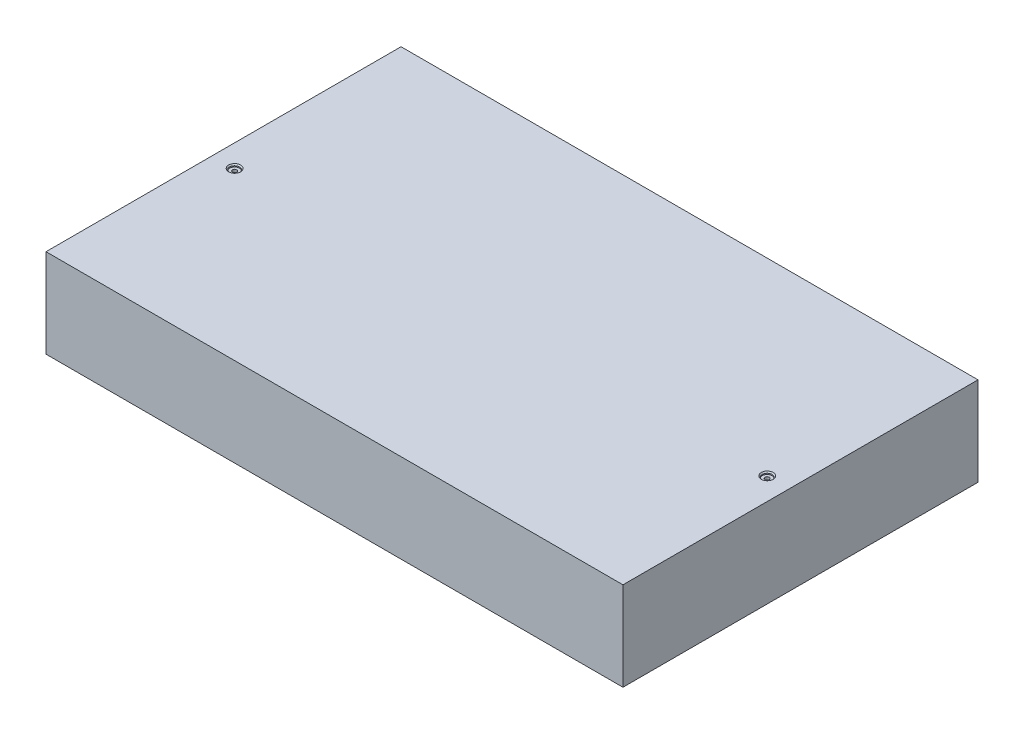
from build123d import *

# Parameters (mm, degrees)
SKETCH1_W                                   = 330.2
SKETCH1_H                                   = 203.2
BOSS_EXTRUDE1_DEPTH                         = 50.8
CUT_EXTRUDE1_DEPTH                          = 12.7
CBORE_FOR_2_BINDING_HEAD_MACHINE_SC_2_COUNT = 2
CBORE_FOR_2_BINDING_HEAD_MACHINE_SC_2_PITCH = 304.799059425


with BuildPart() as part:
    # Sketch1 → Boss-Extrude1 (new body)
    with BuildSketch(Plane(origin=(0, 0, 0), x_dir=(1, 0, 0), z_dir=(0, 1, 0))):
        with Locations((165.1, 101.6)):
            Rectangle(SKETCH1_W, SKETCH1_H)
    extrude(amount=BOSS_EXTRUDE1_DEPTH)

    # Sketch3 → Cut-Extrude1 (cut)
    with BuildSketch(Plane.XZ):
        Polygon((279.4, -181.265982614), (279.4, -104.941398829), (279.4, -104.237946444), (279.4, -21.934017386), (50.8, -21.934017386), (50.8, -181.265982614), align=None)
    extrude(amount=-CUT_EXTRUDE1_DEPTH, mode=Mode.SUBTRACT)

    # Sketch5 → CBORE for #2 Binding Head Machine Screw1 (revolve, cut)
    with BuildSketch(Plane(origin=(12.700940575, 50.8, -95.25), x_dir=(0, 0, 1), z_dir=(1, 0, 0))):
        Polygon((0, 0), (0, 50.8), (1.2192, 50.8), (1.2192, 1.27), (2.77876, 1.27), (2.77876, 0.635), (3.41376, 0), align=None)
    cbore_for_2_binding_head_machine_screw1 = revolve(axis=Axis((12.700940575, 57.15, -95.25), (0, -1, 0)), mode=Mode.SUBTRACT)

    # CBORE for _2 Binding Head Machine Sc 2: CBORE for #2 Binding Head Machine Screw1 ×2
    with Locations(*[(i * CBORE_FOR_2_BINDING_HEAD_MACHINE_SC_2_PITCH, 0, 0) for i in range(1, CBORE_FOR_2_BINDING_HEAD_MACHINE_SC_2_COUNT)]):
        add(cbore_for_2_binding_head_machine_screw1, mode=Mode.SUBTRACT)


solid = part.part
